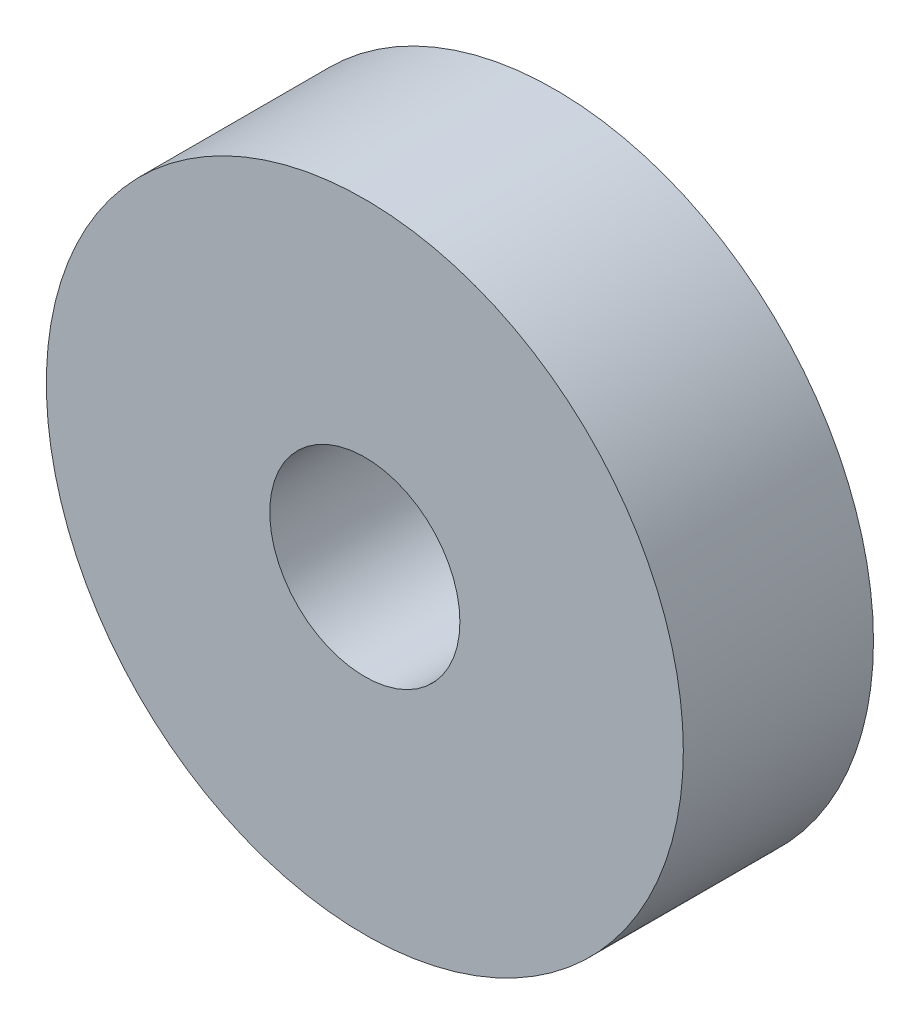
from build123d import *

# Parameters (mm, degrees)
SKETCH1_R           = 10.049875621
SKETCH1_R_2         = 3
BOSS_EXTRUDE1_DEPTH = 6


with BuildPart() as part:
    # Sketch1 → Boss-Extrude1 (new body)
    with BuildSketch(Plane.XY):
        with Locations((0.57738265, 0.096230442)):
            Circle(SKETCH1_R)
        with Locations((0.57738265, 0.096230442)):
            Circle(SKETCH1_R_2, mode=Mode.SUBTRACT)
    extrude(amount=BOSS_EXTRUDE1_DEPTH)


solid = part.part
